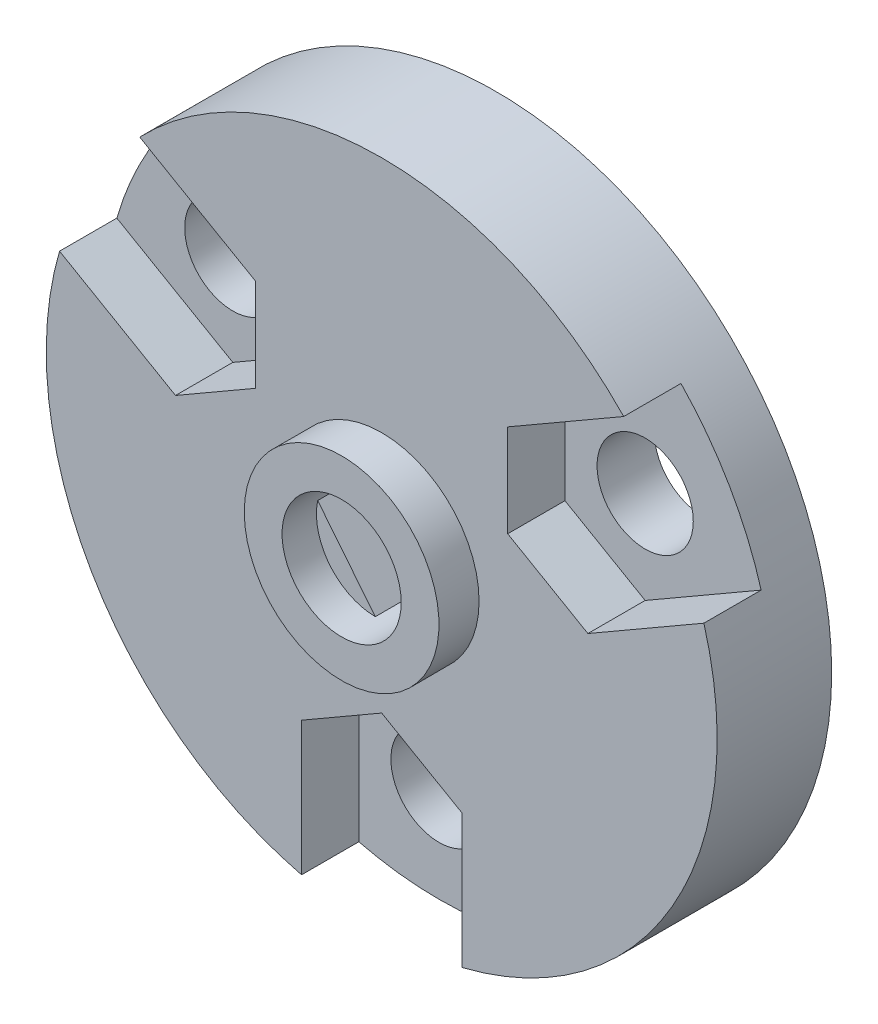
from build123d import *

# Parameters (mm, degrees)
SKETCH1_R           = 14.642304845
BOSS_EXTRUDE1_DEPTH = 2.5
BOSS_EXTRUDE2_DEPTH = 2.5
CUT_EXTRUDE1_REACH  = 22.858
SKETCH3_R           = 2.1
SKETCH4_R           = 4.25
BOSS_EXTRUDE3_DEPTH = 1.75
SKETCH5_R           = 2.6
CUT_EXTRUDE2_DEPTH  = 1.5
CUT_EXTRUDE3_DEPTH  = 22.779730999


with BuildPart() as part:
    # Sketch1 → Boss-Extrude1 (new body)
    with BuildSketch(Plane.XY):
        Circle(SKETCH1_R)
    extrude(amount=BOSS_EXTRUDE1_DEPTH)

    # Sketch2 → Boss-Extrude2 (add)
    with BuildSketch(Plane.XY.offset(2.5)):
        with BuildLine():
            Line((5.5, 7.216878365), (10.563014188, 10.140010969))
            ThreePointArc((10.563014188, 10.140010969), (10.103038739, 10.598381925), (9.623192391, 11.035907729))
            ThreePointArc((9.623192391, 11.035907729), (-0.649210292, 14.627905427), (-10.563014188, 10.140010969))
            Line((-10.563014188, 10.140010969), (-5.5, 7.216878365))
            Line((-5.5, 7.216878365), (-5.5, 3.175426481))
            Line((-5.5, 3.175426481), (-9, 1.154700538))
            Line((-9, 1.154700538), (-14.063014188, 4.077833143))
            ThreePointArc((-14.063014188, 4.077833143), (-12.680607966, -7.321152423), (-3.5, -14.217844112))
            Line((-3.5, -14.217844112), (-3.5, -8.371578903))
            Line((-3.5, -8.371578903), (0, -6.350852961))
            Line((0, -6.350852961), (3.5, -8.371578903))
            Line((3.5, -8.371578903), (3.5, -14.217844112))
            ThreePointArc((3.5, -14.217844112), (12.680607966, -7.321152423), (14.063014188, 4.077833143))
            Line((14.063014188, 4.077833143), (9, 1.154700538))
            Line((9, 1.154700538), (5.5, 3.175426481))
            Line((5.5, 3.175426481), (5.5, 7.216878365))
        make_face()
    extrude(amount=BOSS_EXTRUDE2_DEPTH)

    # Sketch3 → Cut-Extrude1 (cut, up to next)
    with BuildSketch(Plane.XY.offset(2.5), mode=Mode.PRIVATE) as cut_extrude1_sk1:
        with Locations((-9, 5.196152423)):
            Circle(SKETCH3_R)
    cut_extrude1_tool1 = extrude(cut_extrude1_sk1.sketch, amount=-CUT_EXTRUDE1_REACH, mode=Mode.PRIVATE) & part.part
    # Sketch3 → Cut-Extrude1 (cut, up to next)
    with BuildSketch(Plane.XY.offset(2.5), mode=Mode.PRIVATE) as cut_extrude1_sk2:
        with Locations((9, 5.196152423)):
            Circle(SKETCH3_R)
    cut_extrude1_tool2 = extrude(cut_extrude1_sk2.sketch, amount=-CUT_EXTRUDE1_REACH, mode=Mode.PRIVATE) & part.part
    # Sketch3 → Cut-Extrude1 (cut, up to next)
    with BuildSketch(Plane.XY.offset(2.5), mode=Mode.PRIVATE) as cut_extrude1_sk3:
        with Locations((0, -10.392304845)):
            Circle(SKETCH3_R)
    cut_extrude1_tool3 = extrude(cut_extrude1_sk3.sketch, amount=-CUT_EXTRUDE1_REACH, mode=Mode.PRIVATE) & part.part
    add(cut_extrude1_tool1.solids().sort_by_distance((-9, 5.196152, 2.5))[0], mode=Mode.SUBTRACT)
    add(cut_extrude1_tool2.solids().sort_by_distance((9, 5.196152, 2.5))[0], mode=Mode.SUBTRACT)
    add(cut_extrude1_tool3.solids().sort_by_distance((0, -10.392305, 2.5))[0], mode=Mode.SUBTRACT)

    # Sketch4 → Boss-Extrude3 (add)
    with BuildSketch(Plane.XY.offset(5)):
        with Locations(Location((0, 0, 0), (0, 0, 180))):
            Circle(SKETCH4_R)
    extrude(amount=BOSS_EXTRUDE3_DEPTH)

    # Sketch5 → Cut-Extrude2 (cut)
    with BuildSketch(Plane.XY.offset(6.75)):
        Circle(SKETCH5_R)
    extrude(amount=-CUT_EXTRUDE2_DEPTH, mode=Mode.SUBTRACT)

    # Sketch6 → Cut-Extrude3 (cut, through all)
    with BuildSketch(Plane.XY.offset(6.75)):
        with BuildLine():
            Line((2.544199592, -0.535769015), (0.030619782, 2.599819692))
            ThreePointArc((0.030619782, 2.599819692), (-1.626221745, 2.028645567), (-2.544199592, 0.535769015))
            Line((-2.544199592, 0.535769015), (-0.030619782, -2.599819692))
            ThreePointArc((-0.030619782, -2.599819692), (1.626221745, -2.028645567), (2.544199592, -0.535769015))
        make_face()
    extrude(amount=-CUT_EXTRUDE3_DEPTH, mode=Mode.SUBTRACT)


solid = part.part
